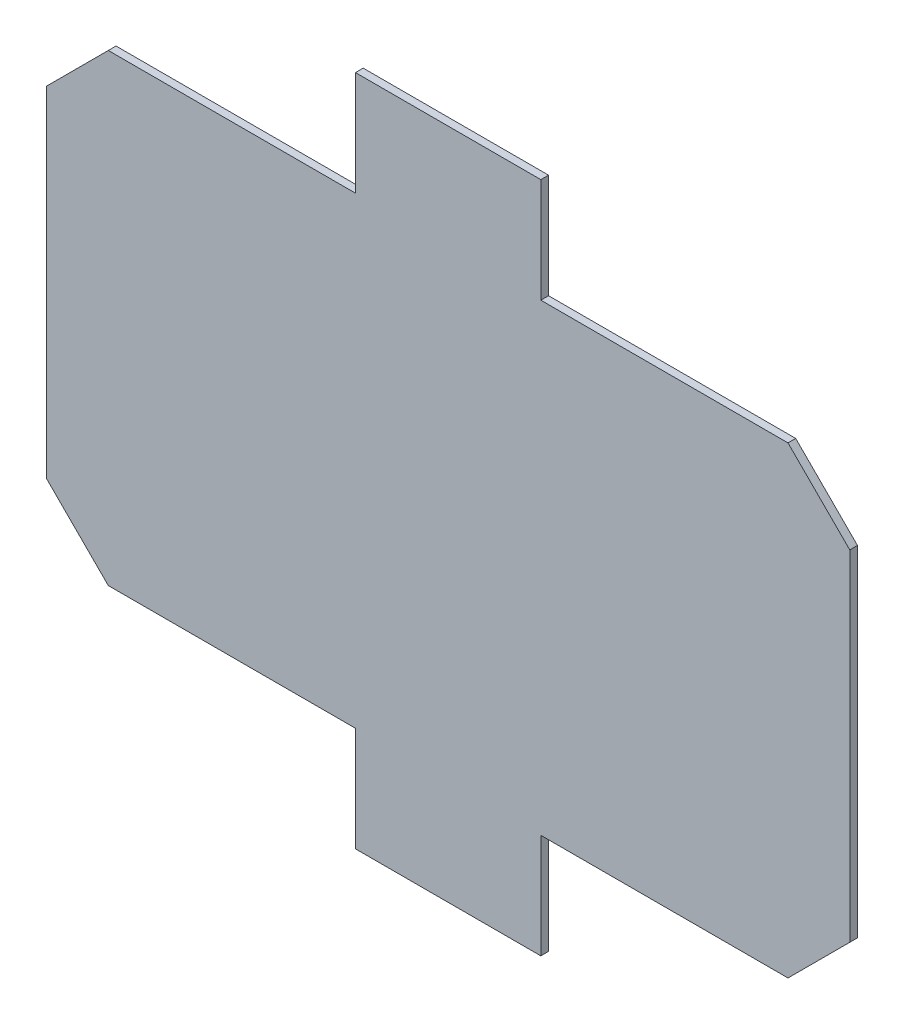
from build123d import *

# Parameters (mm, degrees)
SKETCH1_W           = 120
SKETCH1_H           = 67.6
SKETCH1_W_2         = 200
SKETCH1_H_2         = 300
BOSS_EXTRUDE1_DEPTH = 5
CHAMFER1_SIZE       = 40


with BuildPart() as part:
    # Sketch1 → Boss-Extrude1 (new body)
    with BuildSketch(Plane.XY):
        with Locations((0, 358.8)):
            Rectangle(SKETCH1_W, SKETCH1_H)
        with Locations((-160, 175)):
            Rectangle(SKETCH1_W_2, SKETCH1_H_2)
        with Locations((0, 175)):
            Rectangle(SKETCH1_W, SKETCH1_H_2)
        with Locations((160, 175)):
            Rectangle(SKETCH1_W_2, SKETCH1_H_2)
        with Locations((0, -8.8)):
            Rectangle(SKETCH1_W, SKETCH1_H)
    extrude(amount=BOSS_EXTRUDE1_DEPTH)

    # Chamfer1
    chamfer1_edges = [part.edges().sort_by_distance(p)[0] for p in [
        (260, 325, 2.5),
        (260, 25, 2.5),
        (-260, 25, 2.5),
        (-260, 325, 2.5),
    ]]
    chamfer(chamfer1_edges, length=CHAMFER1_SIZE)


solid = part.part
